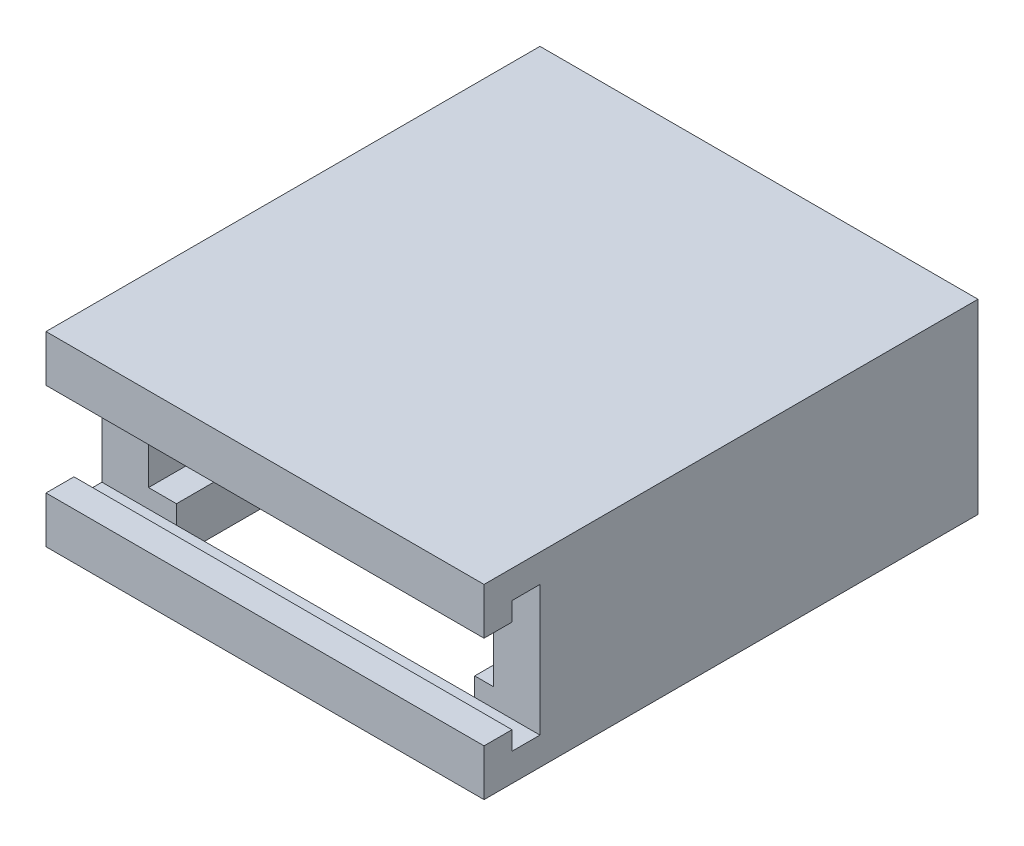
from build123d import *

# Parameters (mm, degrees)
EXTRUDE_1_DEPTH = 42
SKETCH_2_W      = 8
SKETCH_2_H      = 42
SKETCH_2_W_2    = 7
EXTRUDE_2_DEPTH = 5
SKETCH_3_W      = 47
SKETCH_3_H      = 20
EXTRUDE_3_DEPTH = 5
EXTRUDE_4_DEPTH = 47


with BuildPart() as part:
    # 스케치1 → 보스-돌출1 (new body)
    with BuildSketch(Plane.XY):
        Polygon((-5, 0), (0, 0), (0, 10), (37, 10), (37, 0), (42, 0), (42, 15), (-5, 15), align=None)
    extrude(amount=EXTRUDE_1_DEPTH)

    # 스케치2 → 보스-돌출2 (add)
    with BuildSketch(Plane.XZ):
        with Locations((-1, 21)):
            Rectangle(SKETCH_2_W, SKETCH_2_H)
        with Locations((38.5, 21)):
            Rectangle(SKETCH_2_W_2, SKETCH_2_H)
    extrude(amount=EXTRUDE_2_DEPTH)

    # 스케치3 → 보스-돌출3 (add)
    with BuildSketch(Plane(origin=(0, 0, 0), x_dir=(-1, 0, 0), z_dir=(0, 0, -1))):
        with Locations((-18.5, 5)):
            Rectangle(SKETCH_3_W, SKETCH_3_H)
    extrude(amount=EXTRUDE_3_DEPTH)

    # 스케치4 → 보스-돌출4 (add)
    with BuildSketch(Plane.ZY.offset(5)):
        Polygon((42, 15), (48, 15), (48, 10), (45, 10), (45, 12), (42, 12), align=None)
        Polygon((42, -5), (48, -5), (48, 0), (45, 0), (45, -2), (42, -2), align=None)
    extrude(amount=-EXTRUDE_4_DEPTH)


solid = part.part
